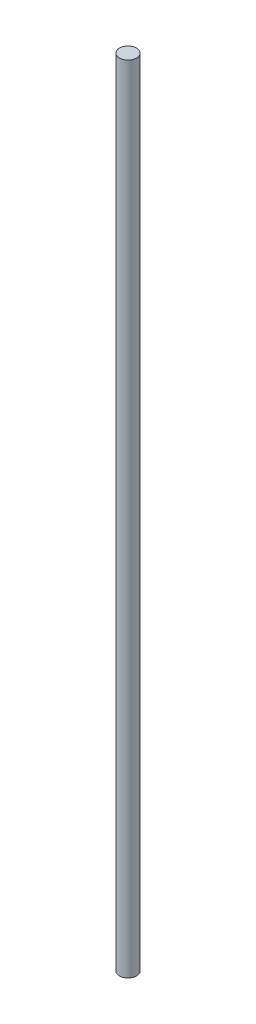
from build123d import *

# Parameters (mm, degrees)
SKETCH1_R           = 4
BOSS_EXTRUDE1_DEPTH = 370


with BuildPart() as part:
    # Sketch1 → Boss-Extrude1 (new body)
    with BuildSketch(Plane(origin=(0, 0, 0), x_dir=(1, 0, 0), z_dir=(0, 1, 0))):
        with Locations(Location((0, 0, 0), (0, 0, 270))):
            Circle(SKETCH1_R)
    extrude(amount=BOSS_EXTRUDE1_DEPTH)


solid = part.part
